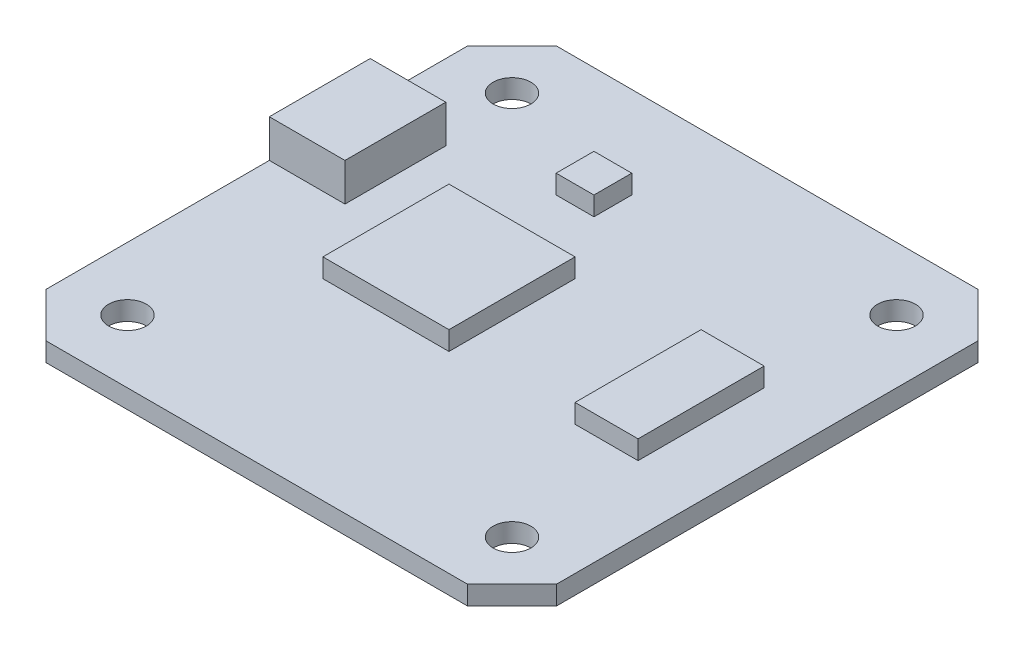
from build123d import *

# Parameters (mm, degrees)
SKETCH1_R           = 1.5
BOSS_EXTRUDE1_DEPTH = 1.5
SKETCH2_W           = 10
SKETCH2_H           = 10
SKETCH2_W_2         = 5
SKETCH2_W_3         = 3
SKETCH2_H_2         = 3
BOSS_EXTRUDE2_DEPTH = 1.5
SKETCH3_W           = 6
SKETCH3_H           = 8
BOSS_EXTRUDE3_DEPTH = 3


with BuildPart() as part:
    # Sketch1 → Boss-Extrude1 (new body)
    with BuildSketch(Plane(origin=(0, 0, 0), x_dir=(1, 0, 0), z_dir=(0, 1, 0))):
        Polygon((16.714466094, 20.25), (-16.714466094, 20.25), (-20.25, 16.714466094), (-20.25, -16.714466094), (-16.714466094, -20.25), (16.714466094, -20.25), (20.25, -16.714466094), (20.25, 16.714466094), align=None)
        with Locations(Location((-15.25, 15.25, 0), (0, 0, 270))):
            Circle(SKETCH1_R, mode=Mode.SUBTRACT)
        with Locations(Location((-15.25, -15.25, 0), (0, 0, 270))):
            Circle(SKETCH1_R, mode=Mode.SUBTRACT)
        with Locations(Location((15.25, -15.25, 0), (0, 0, 90))):
            Circle(SKETCH1_R, mode=Mode.SUBTRACT)
        with Locations(Location((15.25, 15.25, 0), (0, 0, 90))):
            Circle(SKETCH1_R, mode=Mode.SUBTRACT)
    extrude(amount=BOSS_EXTRUDE1_DEPTH)

    # Sketch2 → Boss-Extrude2 (add)
    with BuildSketch(Plane(origin=(0, 1.5, 0), x_dir=(1, 0, 0), z_dir=(0, 1, 0))):
        with Locations((-5, 0)):
            Rectangle(SKETCH2_W, SKETCH2_H)
        with Locations((12.5, 0)):
            Rectangle(SKETCH2_W_2, SKETCH2_H)
        with Locations((-5, 11.5)):
            Rectangle(SKETCH2_W_3, SKETCH2_H_2)
    extrude(amount=BOSS_EXTRUDE2_DEPTH)

    # Sketch3 → Boss-Extrude3 (add)
    with BuildSketch(Plane(origin=(0, 1.5, 0), x_dir=(1, 0, 0), z_dir=(0, 1, 0))):
        with Locations((-17.25, 5)):
            Rectangle(SKETCH3_W, SKETCH3_H)
    extrude(amount=BOSS_EXTRUDE3_DEPTH)


solid = part.part
